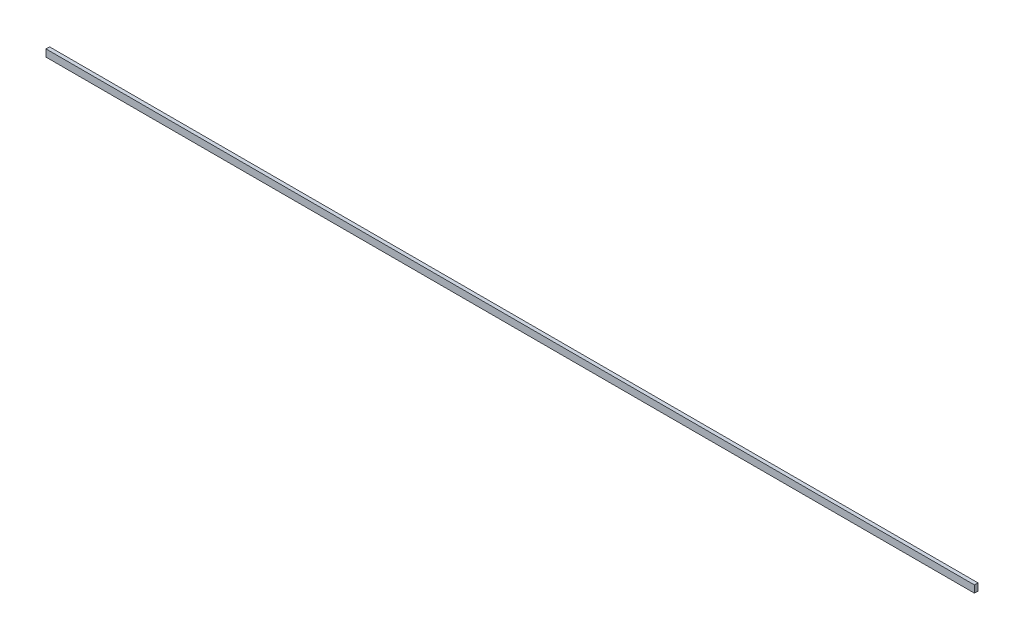
from build123d import *

# Parameters (mm, degrees)
SKETCH1_W           = 1300
SKETCH1_H           = 5
BOSS_EXTRUDE1_DEPTH = 10


with BuildPart() as part:
    # Sketch1 → Boss-Extrude1 (new body)
    with BuildSketch(Plane(origin=(0, 0, 0), x_dir=(1, 0, 0), z_dir=(0, 1, 0))):
        with Locations((650, -2.5)):
            Rectangle(SKETCH1_W, SKETCH1_H)
    extrude(amount=BOSS_EXTRUDE1_DEPTH)


solid = part.part
